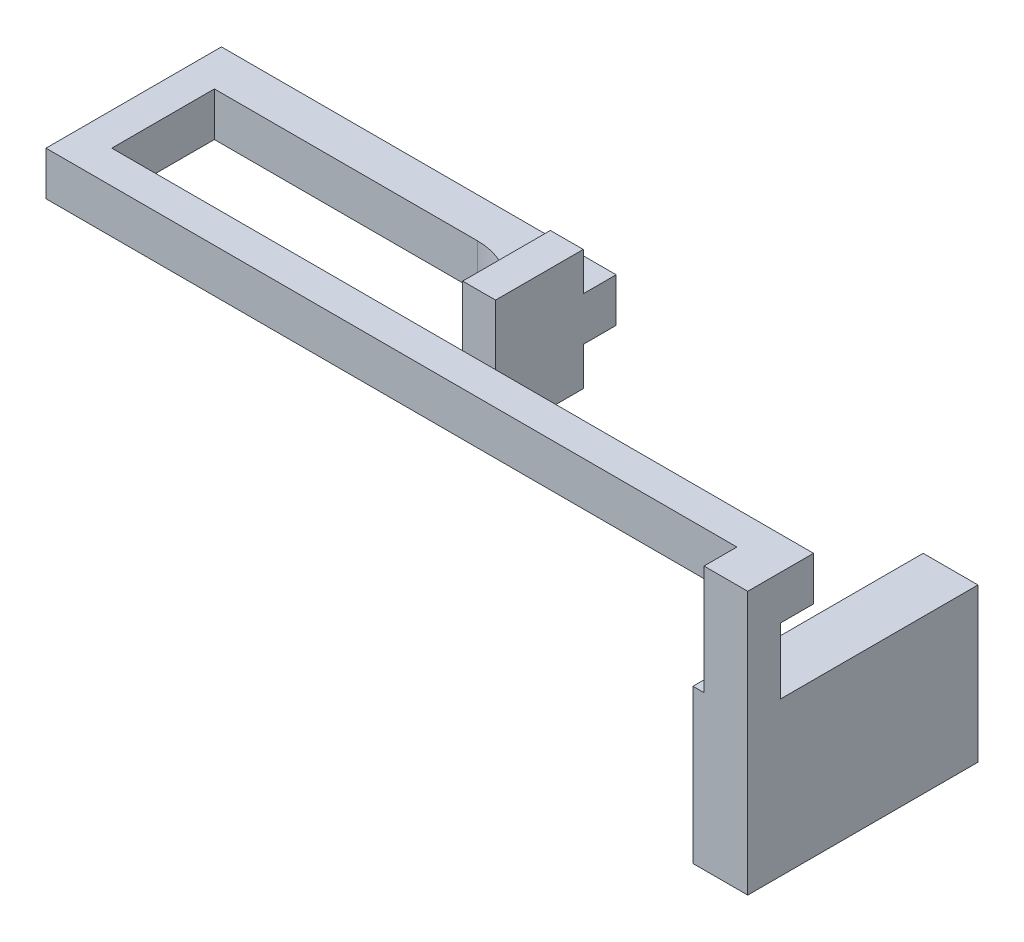
from build123d import *

# Parameters (mm, degrees)
SKETCH1_W           = 81.28
SKETCH1_H           = 5.08
BOSS_EXTRUDE1_DEPTH = 3.81
SKETCH3_W           = 5.067533081
SKETCH3_H           = 3.81
BOSS_EXTRUDE2_DEPTH = 30.48
SKETCH4_W           = 26.67
SKETCH4_H           = 17.78
BOSS_EXTRUDE3_DEPTH = 6.35
SKETCH6_W           = 20.32
SKETCH6_H           = 5.08
BOSS_EXTRUDE4_DEPTH = 3.81
SKETCH7_W           = 4.626355507
SKETCH7_H           = 5.08
BOSS_EXTRUDE5_DEPTH = 38.1
SKETCH8_W           = 13.97
SKETCH8_H           = 13.97
BOSS_EXTRUDE6_DEPTH = 3.81
SKETCH9_W           = 3.81
SKETCH9_H           = 4.445
CUT_EXTRUDE1_DEPTH  = 56.663101782
FILLET1_R           = 7.62


with BuildPart() as part:
    # Sketch1 → Boss-Extrude1 (new body)
    with BuildSketch(Plane.XY):
        with Locations((-40.64, 2.54)):
            Rectangle(SKETCH1_W, SKETCH1_H)
    extrude(amount=BOSS_EXTRUDE1_DEPTH)

    # Sketch3 → Boss-Extrude2 (add)
    with BuildSketch(Plane(origin=(0, 5.08, 0), x_dir=(1, 0, 0), z_dir=(0, 1, 0))):
        with Locations((-2.533766541, -5.715)):
            Rectangle(SKETCH3_W, SKETCH3_H)
    extrude(amount=-BOSS_EXTRUDE2_DEPTH)

    # Sketch4 → Boss-Extrude3 (add)
    with BuildSketch(Plane(origin=(0, 0, 0), x_dir=(0, 0, -1), z_dir=(1, 0, 0))):
        with Locations((5.715, -16.51)):
            Rectangle(SKETCH4_W, SKETCH4_H)
    extrude(amount=-BOSS_EXTRUDE3_DEPTH)

    # Sketch6 → Boss-Extrude4 (add)
    with BuildSketch(Plane.ZY.offset(81.28)):
        with Locations((-6.35, 2.54)):
            Rectangle(SKETCH6_W, SKETCH6_H)
    extrude(amount=BOSS_EXTRUDE4_DEPTH)

    # Sketch7 → Boss-Extrude5 (add)
    with BuildSketch(Plane(origin=(-81.28, 0, 0), x_dir=(0, 0, -1), z_dir=(1, 0, 0))):
        with Locations((14.196822247, 2.54)):
            Rectangle(SKETCH7_W, SKETCH7_H)
    extrude(amount=BOSS_EXTRUDE5_DEPTH)

    # Sketch8 → Boss-Extrude6 (add)
    with BuildSketch(Plane(origin=(-43.18, 0, 0), x_dir=(0, 0, -1), z_dir=(1, 0, 0))):
        with Locations((9.525, 2.54)):
            Rectangle(SKETCH8_W, SKETCH8_H)
    extrude(amount=BOSS_EXTRUDE6_DEPTH)

    # Sketch9 → Cut-Extrude1 (cut, through all)
    with BuildSketch(Plane(origin=(-39.37, 0, 0), x_dir=(0, 0, -1), z_dir=(1, 0, 0))):
        with Locations((14.605, -2.2225)):
            Rectangle(SKETCH9_W, SKETCH9_H)
        with Locations((14.605, 7.3025)):
            Rectangle(SKETCH9_W, SKETCH9_H)
    extrude(amount=-CUT_EXTRUDE1_DEPTH, mode=Mode.SUBTRACT)

    # Fillet1
    fillet1_edges = [part.edges().sort_by_distance(p)[0] for p in [
        (-43.18, 2.54, -11.883644493),
    ]]
    fillet(fillet1_edges, radius=FILLET1_R)


solid = part.part
